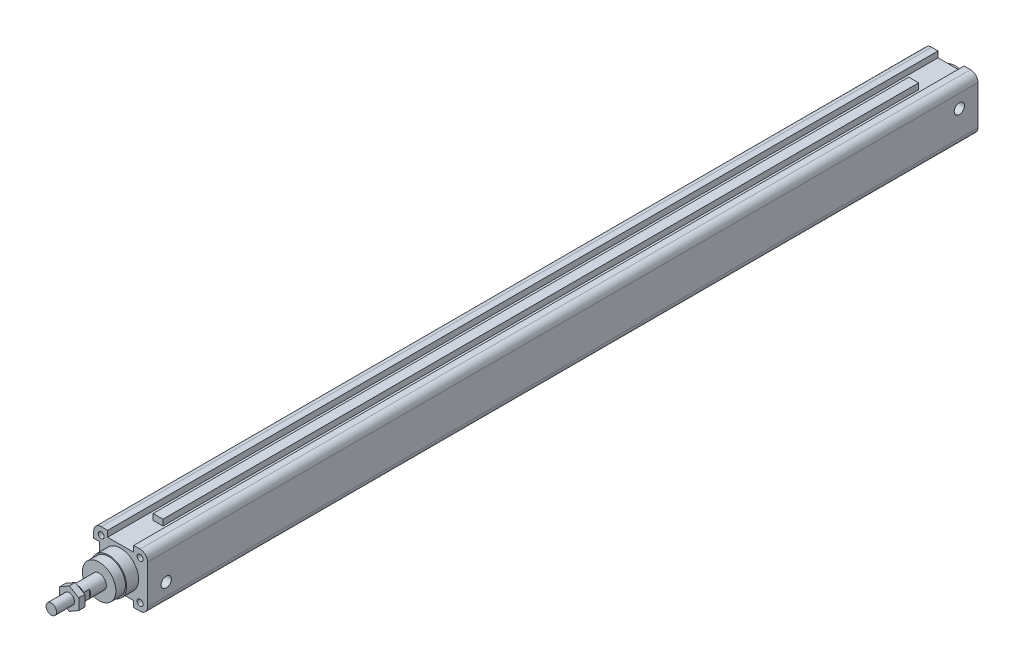
from build123d import *

# Parameters (mm, degrees)
BODY_DEPTH         = 347
SK_FRONT_TAPS_R    = 2.5
FRONT_TAPS_DEPTH   = 16
SK_PORTS_R         = 4.283
PORTS_DEPTH        = 10
SK_BACK_PLATE_R    = 15
BACK_PLATE_DEPTH   = 4
FRONT_START        = -10
SK_FRONT_PLATE_R   = 15
FRONT_PLATE_DEPTH  = 10
SK_ROD_HOLDER_R    = 14
ROD_HOLDER_DEPTH   = 18
SK_ROD_R           = 6
ROD_DEPTH          = 730
SK_ROD_THREAD_R    = 4.4
ROD_THREAD_DEPTH   = 22
ROD_START          = -5
ROD_FLATS_DEPTH    = 5
SENSOR_START       = -631.6
SK_SENSOR_SLOT_W   = 6.8
SK_SENSOR_SLOT_H   = 5
SK_SENSOR_SLOT_W_2 = 5
SK_SENSOR_SLOT_H_2 = 6.8
SENSOR_SLOT_DEPTH  = 631.6
FRONT_CUT_REACH    = 669.559
SK_FRONT_CUT_W     = 21.8
SK_FRONT_CUT_H     = 5
SK_FRONT_CUT_W_2   = 5
SK_FRONT_CUT_H_2   = 21.8
BACK_CUT_REACH     = 723.502
SK_BACK_CUT_W      = 21.8
SK_BACK_CUT_H      = 5
SK_BACK_CUT_W_2    = 5
SK_BACK_CUT_H_2    = 21.8
ROD_NUT_DEPTH      = 5


with BuildPart() as part:
    # sk Body → Body (new, symmetric)
    with BuildSketch(Plane.XY):
        with BuildLine():
            Line((-16.25, 22.5), (16.25, 22.5))
            ThreePointArc((16.25, 22.5), (20.669417382, 20.669417382), (22.5, 16.25))
            Line((22.5, 16.25), (22.5, -16.25))
            ThreePointArc((22.5, -16.25), (20.669417382, -20.669417382), (16.25, -22.5))
            Line((16.25, -22.5), (-16.25, -22.5))
            ThreePointArc((-16.25, -22.5), (-20.669417382, -20.669417382), (-22.5, -16.25))
            Line((-22.5, -16.25), (-22.5, 16.25))
            ThreePointArc((-22.5, 16.25), (-20.669417382, 20.669417382), (-16.25, 22.5))
        make_face()
    extrude(amount=BODY_DEPTH, both=True)

    # sk Front Taps → Front Taps (cut)
    with BuildSketch(Plane.XY.offset(347)):
        with Locations((16.25, 16.25)):
            Circle(SK_FRONT_TAPS_R)
        with Locations((-16.25, 16.25)):
            Circle(SK_FRONT_TAPS_R)
        with Locations((-16.25, -16.25)):
            Circle(SK_FRONT_TAPS_R)
        with Locations((16.25, -16.25)):
            Circle(SK_FRONT_TAPS_R)
    front_taps = extrude(amount=-FRONT_TAPS_DEPTH, mode=Mode.SUBTRACT)

    # Back Taps: Front Taps across plane
    add(front_taps.mirror(Plane.XY), mode=Mode.SUBTRACT)

    # sk Ports → Ports (cut)
    with BuildSketch(Plane(origin=(22.5, 0, 0), x_dir=(0, 0, -1), z_dir=(1, 0, 0))):
        with Locations((-331.4, -6)):
            Circle(SK_PORTS_R)
        with Locations((331.4, 5.2)):
            Circle(SK_PORTS_R)
    extrude(amount=-PORTS_DEPTH, mode=Mode.SUBTRACT)

    # sk Back Plate → Back Plate (add)
    with BuildSketch(Plane(origin=(0, 0, -347), x_dir=(-1, 0, 0), z_dir=(0, 0, -1))):
        Circle(SK_BACK_PLATE_R)
    extrude(amount=BACK_PLATE_DEPTH)

    # sk Front Plate → Front Plate (add)
    with BuildSketch(Plane(origin=(0, 0, 347), x_dir=(-1, 0, 0), z_dir=(0, 0, -1)).offset(FRONT_START)):
        Circle(SK_FRONT_PLATE_R)
    extrude(amount=FRONT_PLATE_DEPTH)

    # sk Rod Holder → Rod Holder (add)
    with BuildSketch(Plane(origin=(0, 0, 347), x_dir=(-1, 0, 0), z_dir=(0, 0, -1))):
        Circle(SK_ROD_HOLDER_R)
    extrude(amount=-ROD_HOLDER_DEPTH)

    # sk Rod → Rod (add)
    with BuildSketch(Plane(origin=(0, 0, -347), x_dir=(-1, 0, 0), z_dir=(0, 0, -1))):
        Circle(SK_ROD_R)
    extrude(amount=-ROD_DEPTH)

    # sk Rod Thread → Rod Thread (add)
    with BuildSketch(Plane.XY.offset(383)):
        with Locations(Location((0, 0, 0), (0, 0, 180))):
            Circle(SK_ROD_THREAD_R)
    extrude(amount=ROD_THREAD_DEPTH)

    # sk Rod Flats → Rod Flats (cut)
    with BuildSketch(Plane.XY.offset(383).offset(ROD_START)):
        with BuildLine():
            Line((-5, 3.31662479), (-5, -3.31662479))
            ThreePointArc((-5, -3.31662479), (-6, 0), (-5, 3.31662479))
        make_face()
        with BuildLine():
            Line((5, 3.31662479), (5, -3.31662479))
            ThreePointArc((5, -3.31662479), (6, 0), (5, 3.31662479))
        make_face()
    extrude(amount=ROD_FLATS_DEPTH, mode=Mode.SUBTRACT)

    # sk Sensor Slot → Sensor Slot (cut)
    with BuildSketch(Plane.XY.offset(315.8).offset(SENSOR_START)):
        with Locations((-7.5, 20)):
            Rectangle(SK_SENSOR_SLOT_W, SK_SENSOR_SLOT_H)
        with Locations((7.5, 20)):
            Rectangle(SK_SENSOR_SLOT_W, SK_SENSOR_SLOT_H)
        with Locations((7.5, -20)):
            Rectangle(SK_SENSOR_SLOT_W, SK_SENSOR_SLOT_H)
        with Locations((-7.5, -20)):
            Rectangle(SK_SENSOR_SLOT_W, SK_SENSOR_SLOT_H)
        with Locations((-20, -7.5)):
            Rectangle(SK_SENSOR_SLOT_W_2, SK_SENSOR_SLOT_H_2)
        with Locations((-20, 7.5)):
            Rectangle(SK_SENSOR_SLOT_W_2, SK_SENSOR_SLOT_H_2)
    extrude(amount=SENSOR_SLOT_DEPTH, mode=Mode.SUBTRACT)

    # sk Front Cut → Front Cut (cut, up to next)
    with BuildSketch(Plane.XY.offset(315.8), mode=Mode.PRIVATE) as front_cut_sk1:
        with Locations((0, 20)):
            Rectangle(SK_FRONT_CUT_W, SK_FRONT_CUT_H)
    front_cut_tool1 = extrude(front_cut_sk1.sketch, amount=FRONT_CUT_REACH, mode=Mode.PRIVATE) & part.part
    # sk Front Cut → Front Cut (cut, up to next)
    with BuildSketch(Plane.XY.offset(315.8), mode=Mode.PRIVATE) as front_cut_sk2:
        with Locations((-20, 0)):
            Rectangle(SK_FRONT_CUT_W_2, SK_FRONT_CUT_H_2)
    front_cut_tool2 = extrude(front_cut_sk2.sketch, amount=FRONT_CUT_REACH, mode=Mode.PRIVATE) & part.part
    # sk Front Cut → Front Cut (cut, up to next)
    with BuildSketch(Plane.XY.offset(315.8), mode=Mode.PRIVATE) as front_cut_sk3:
        with Locations((0, -20)):
            Rectangle(SK_FRONT_CUT_W, SK_FRONT_CUT_H)
    front_cut_tool3 = extrude(front_cut_sk3.sketch, amount=FRONT_CUT_REACH, mode=Mode.PRIVATE) & part.part
    add(front_cut_tool1.solids().sort_by_distance((0, 20, 315.8))[0], mode=Mode.SUBTRACT)
    add(front_cut_tool2.solids().sort_by_distance((-20, 0, 315.8))[0], mode=Mode.SUBTRACT)
    add(front_cut_tool3.solids().sort_by_distance((0, -20, 315.8))[0], mode=Mode.SUBTRACT)

    # sk Back Cut → Back Cut (cut, up to next)
    with BuildSketch(Plane(origin=(0, 0, -315.8), x_dir=(-1, 0, 0), z_dir=(0, 0, -1)), mode=Mode.PRIVATE) as back_cut_sk1:
        with Locations((0, 20)):
            Rectangle(SK_BACK_CUT_W, SK_BACK_CUT_H)
    back_cut_tool1 = extrude(back_cut_sk1.sketch, amount=BACK_CUT_REACH, mode=Mode.PRIVATE) & part.part
    # sk Back Cut → Back Cut (cut, up to next)
    with BuildSketch(Plane(origin=(0, 0, -315.8), x_dir=(-1, 0, 0), z_dir=(0, 0, -1)), mode=Mode.PRIVATE) as back_cut_sk2:
        with Locations((20, 0)):
            Rectangle(SK_BACK_CUT_W_2, SK_BACK_CUT_H_2)
    back_cut_tool2 = extrude(back_cut_sk2.sketch, amount=BACK_CUT_REACH, mode=Mode.PRIVATE) & part.part
    # sk Back Cut → Back Cut (cut, up to next)
    with BuildSketch(Plane(origin=(0, 0, -315.8), x_dir=(-1, 0, 0), z_dir=(0, 0, -1)), mode=Mode.PRIVATE) as back_cut_sk3:
        with Locations((0, -20)):
            Rectangle(SK_BACK_CUT_W, SK_BACK_CUT_H)
    back_cut_tool3 = extrude(back_cut_sk3.sketch, amount=BACK_CUT_REACH, mode=Mode.PRIVATE) & part.part
    add(back_cut_tool1.solids().sort_by_distance((0, 20, -315.8))[0], mode=Mode.SUBTRACT)
    add(back_cut_tool2.solids().sort_by_distance((-20, 0, -315.8))[0], mode=Mode.SUBTRACT)
    add(back_cut_tool3.solids().sort_by_distance((0, -20, -315.8))[0], mode=Mode.SUBTRACT)

    # sk Rod Nut → Rod Nut (add)
    with BuildSketch(Plane.XY.offset(385)):
        Polygon((0, -9.237604307), (8, -4.618802154), (8, 4.618802154), (0, 9.237604307), (-8, 4.618802154), (-8, -4.618802154), align=None)
    extrude(amount=ROD_NUT_DEPTH)


solid = part.part
